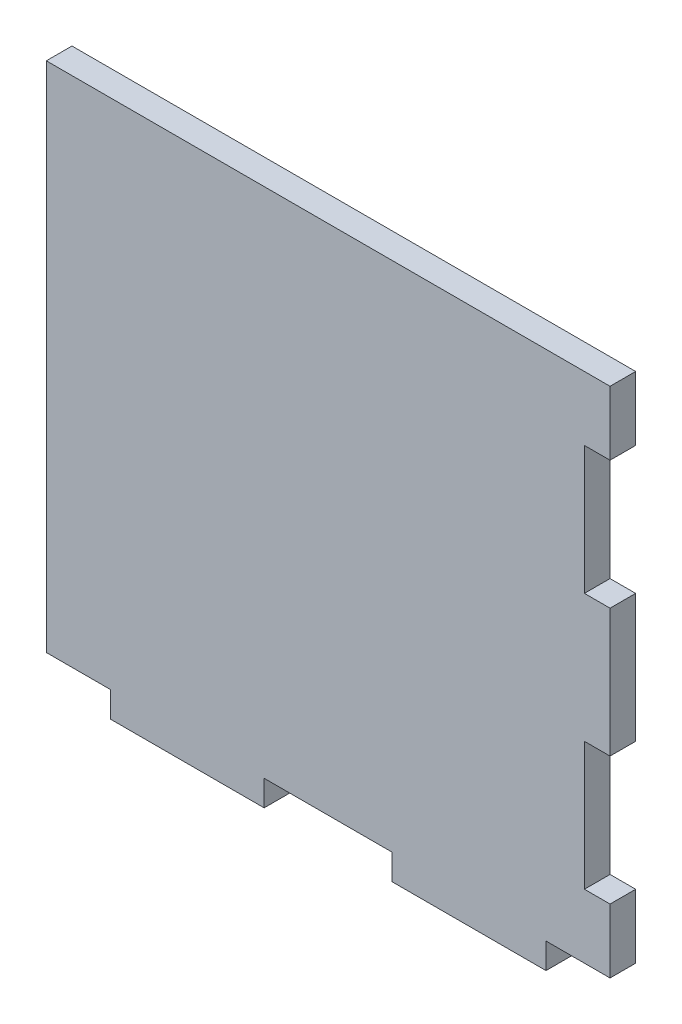
from build123d import *

# Parameters (mm, degrees)
SALIENTE_EXTRUIR1_DEPTH = 5
CROQUIS2_W              = 5
CROQUIS2_H              = 25
CORTAR_EXTRUIR1_DEPTH   = 5


with BuildPart() as part:
    # Croquis1 → Saliente-Extruir1 (new body)
    with BuildSketch(Plane.XY):
        Polygon((0, 0), (12.5, 0), (12.5, -5), (42.5, -5), (42.5, 0), (67.5, 0), (67.5, -5), (97.5, -5), (97.5, 0), (110, 0), (110, 100), (0, 100), align=None)
    extrude(amount=SALIENTE_EXTRUIR1_DEPTH)

    # Croquis2 → Cortar-Extruir1 (cut)
    with BuildSketch(Plane.XY.offset(5)):
        with Locations((107.5, 75)):
            Rectangle(CROQUIS2_W, CROQUIS2_H)
        with Locations((107.5, 25)):
            Rectangle(CROQUIS2_W, CROQUIS2_H)
    extrude(amount=-CORTAR_EXTRUIR1_DEPTH, mode=Mode.SUBTRACT)


solid = part.part
